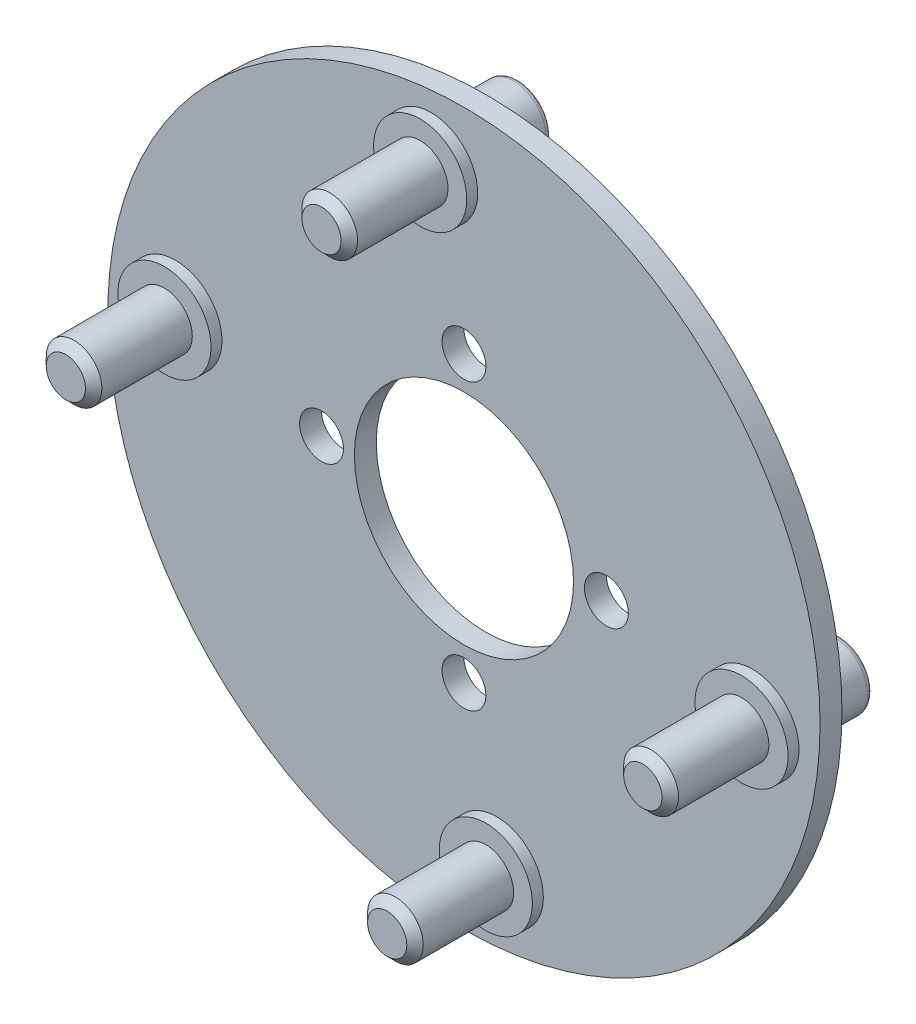
from build123d import *

# Parameters (mm, degrees)
ESQUISSE1_R                  = 32.5
ESQUISSE1_R_2                = 10
EXTRUSION1_DEPTH             = 2
ESQUISSE2_R                  = 2
ENL_V_MAT_EXTRU_1_DEPTH      = 47.005434462
R_P_TITION_CIRCULAIRE1_COUNT = 4
EXTRUSION2_DEPTH             = 1
EXTRUSION2_DEPTH_BACK        = 3.5
ESQUISSE3_R                  = 4.25
ESQUISSE4_R                  = 3
EXTRUSION3_DEPTH             = 4.5
CONG_1_R                     = 0.5
ESQUISSE5_R                  = 2.53945181
ESQUISSE5_R_2                = 2.5
EXTRUSION4_DEPTH             = 9
CHANFREIN1_SIZE              = 0.75


with BuildPart() as part:
    # Esquisse1 → Extrusion1 (new body)
    with BuildSketch(Plane.XY):
        Circle(ESQUISSE1_R)
        Circle(ESQUISSE1_R_2, mode=Mode.SUBTRACT)
    extrude(amount=EXTRUSION1_DEPTH)

    # Esquisse2 → Enlèv. mat.-Extru.1 (cut, through all)
    with BuildSketch(Plane(origin=(0, 0, 0), x_dir=(-1, 0, 0), z_dir=(0, 0, -1))):
        with Locations((0, 13)):
            Circle(ESQUISSE2_R)
    enl_v_mat_extru_1 = extrude(amount=-ENL_V_MAT_EXTRU_1_DEPTH, mode=Mode.SUBTRACT)

    # Répétition circulaire1: Enlèv. mat.-Extru.1 ×4 about axis
    r_p_tition_circulaire1_axis = Axis((0, 0, 2), (0, 0, -1))
    for i in range(1, R_P_TITION_CIRCULAIRE1_COUNT):
        add(enl_v_mat_extru_1.rotate(r_p_tition_circulaire1_axis, i * 360 / R_P_TITION_CIRCULAIRE1_COUNT), mode=Mode.SUBTRACT)

    # Esquisse3 → Extrusion2 (add, two sides: drawn at the far end of the back side and taken through both)
    with BuildSketch(Plane.XY.offset(2).offset(-EXTRUSION2_DEPTH_BACK)):
        with Locations((-2.995616409, 26.330140188)):
            Circle(ESQUISSE3_R)
        with Locations((-26.330140188, 2.995616409)):
            Circle(ESQUISSE3_R)
        with Locations((2.995616409, -26.330140188)):
            Circle(ESQUISSE3_R)
        with Locations((26.330140188, -2.995616409)):
            Circle(ESQUISSE3_R)
    extrude(amount=EXTRUSION2_DEPTH + EXTRUSION2_DEPTH_BACK)

    # Esquisse4 → Extrusion3 (add)
    with BuildSketch(Plane(origin=(0, 0, -1.5), x_dir=(-1, 0, 0), z_dir=(0, 0, -1))):
        with Locations((2.995616409, 26.330140188)):
            Circle(ESQUISSE4_R)
        with Locations((-26.330140188, -2.995616409)):
            Circle(ESQUISSE4_R)
        with Locations((-2.995616409, -26.330140188)):
            Circle(ESQUISSE4_R)
        with Locations((26.330140188, 2.995616409)):
            Circle(ESQUISSE4_R)
    extrude(amount=EXTRUSION3_DEPTH)

    # Congé1
    cong_1_edges = [part.edges().sort_by_distance(p)[0] for p in [
        (-23.330140188, 2.995616409, -6),
        (5.995616409, -26.330140188, -6),
        (29.330140188, -2.995616409, -6),
        (0.004383591, 26.330140188, -6),
        (-1.254383591, -26.330140188, -1.5),
        (-30.580140188, 2.995616409, -1.5),
        (-7.245616409, 26.330140188, -1.5),
        (22.080140188, -2.995616409, -1.5),
    ]]
    fillet(cong_1_edges, radius=CONG_1_R)

    # Esquisse5 → Extrusion4 (add)
    with BuildSketch(Plane.XY.offset(3)):
        with Locations((-2.995616409, 26.330140188)):
            Circle(ESQUISSE5_R)
        with Locations((26.330140188, -2.995616409)):
            Circle(ESQUISSE5_R_2)
        with Locations((-26.330140188, 2.995616409)):
            Circle(ESQUISSE5_R)
        with Locations((2.995616409, -26.330140188)):
            Circle(ESQUISSE5_R)
    extrude(amount=EXTRUSION4_DEPTH)

    # Chanfrein1
    chanfrein1_edges = [part.edges().sort_by_distance(p)[0] for p in [
        (-28.869591998, 2.995616409, 12),
        (0.456164599, -26.330140188, 12),
        (23.830140188, -2.995616409, 12),
        (-5.535068219, 26.330140188, 12),
    ]]
    chamfer(chanfrein1_edges, length=CHANFREIN1_SIZE)


solid = part.part
